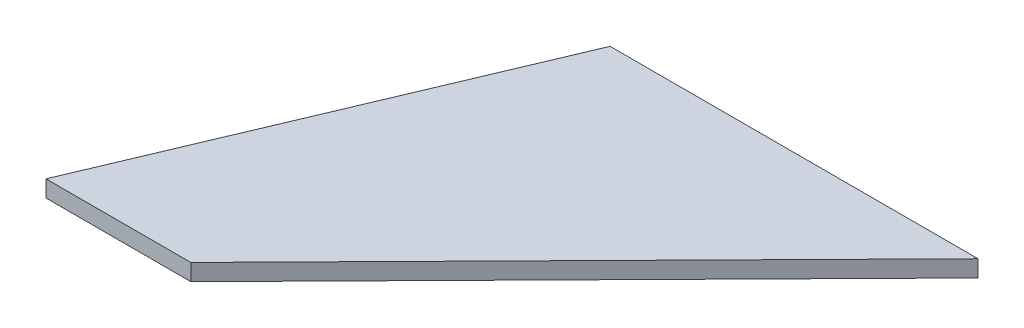
from build123d import *

# Parameters (mm, degrees)
SKETCH1_W           = 263.3434916
SKETCH1_H           = 204.19140391
BOSS_EXTRUDE1_DEPTH = 4.599999944
SKETCH2_OUTSIDE_W   = 331.995
SKETCH2_OUTSIDE_H   = 272.843
CUT_EXTRUDE1_DEPTH  = 334.264285513


with BuildPart() as part:
    # Sketch1 → Boss-Extrude1 (new body)
    with BuildSketch(Plane(origin=(0, 0, 0), x_dir=(1, 0, 0), z_dir=(0, 1, 0))):
        with Locations((131.6717458, 102.095701955)):
            Rectangle(SKETCH1_W, SKETCH1_H)
    extrude(amount=BOSS_EXTRUDE1_DEPTH)

    # Sketch2 outside → Cut-Extrude1 (cut, through all)
    with BuildSketch(Plane.XZ):
        with Locations((131.6715, -102.0955)):
            Rectangle(SKETCH2_OUTSIDE_W, SKETCH2_OUTSIDE_H)
        Polygon((80.943491656, -204.19140391), (182.543491656, -204.19140391), (74.74349161, -94.610571068), (34.7434916, -94.610571068), align=None, mode=Mode.SUBTRACT)
    extrude(amount=-CUT_EXTRUDE1_DEPTH, mode=Mode.SUBTRACT)


solid = part.part
